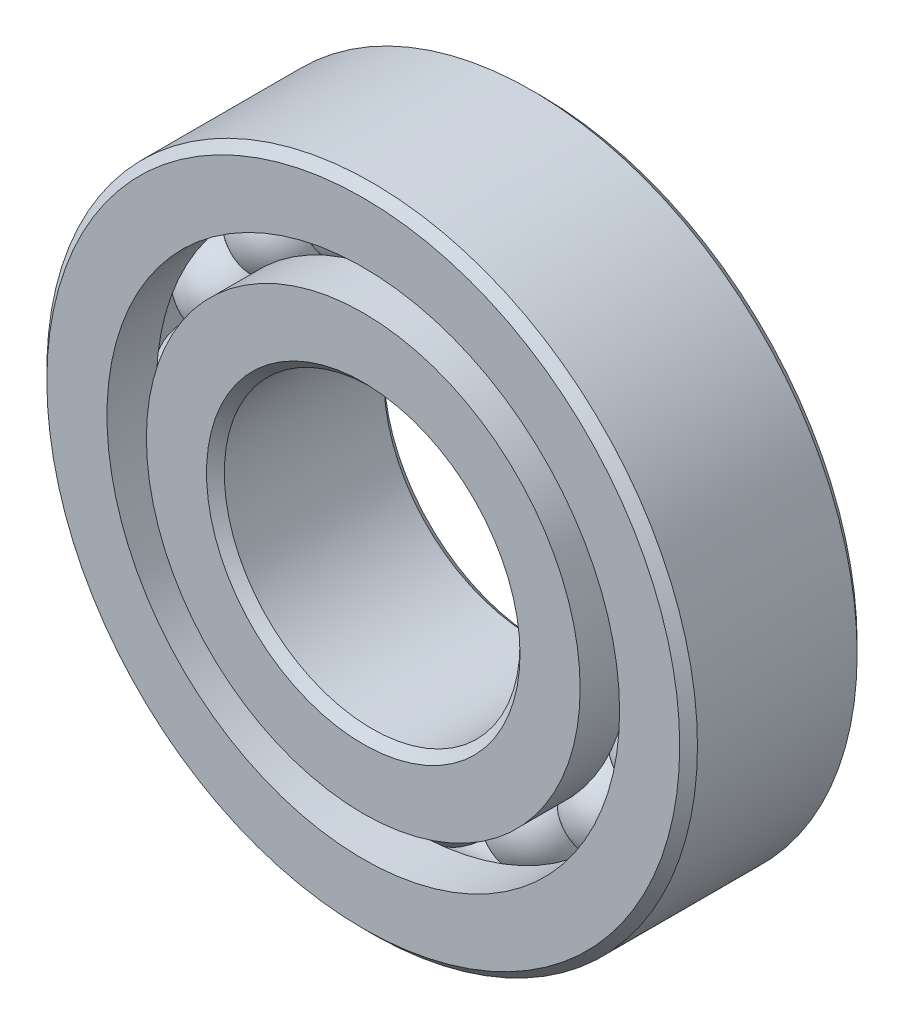
from build123d import *

# Parameters (mm, degrees)
CIRPATTERN1_COUNT = 16


with BuildPart() as part:
    # Sketch2 → Revolve1 (revolve)
    with BuildSketch(Plane(origin=(0, 0, 0), x_dir=(0, 0, -1), z_dir=(1, 0, 0))):
        with BuildLine():
            Line((-1.5, 3.666666667), (-0.666666667, 3.666666667))
            ThreePointArc((-0.666666667, 3.666666667), (0, 3.254644008), (0.666666667, 3.666666667))
            Line((0.666666667, 3.666666667), (1.5, 3.666666667))
            Line((1.5, 3.666666667), (1.5, 2.65))
            Line((1.5, 2.65), (1.35, 2.5))
            Line((1.35, 2.5), (-1.35, 2.5))
            Line((-1.35, 2.5), (-1.5, 2.65))
            Line((-1.5, 2.65), (-1.5, 3.666666667))
        make_face()
        with BuildLine():
            Line((1.35, 5.5), (1.5, 5.35))
            Line((1.5, 5.35), (1.5, 4.333333333))
            Line((1.5, 4.333333333), (0.666666667, 4.333333333))
            ThreePointArc((0.666666667, 4.333333333), (0, 4.745355992), (-0.666666667, 4.333333333))
            Line((-0.666666667, 4.333333333), (-1.5, 4.333333333))
            Line((-1.5, 4.333333333), (-1.5, 5.35))
            Line((-1.5, 5.35), (-1.35, 5.5))
            Line((-1.35, 5.5), (1.35, 5.5))
        make_face()
    revolve(axis=Axis((0, 0, 1.5), (0, 0, -1)))


with BuildPart() as body_2:
    # Sketch3 → Revolve2 (revolve)
    with BuildSketch(Plane(origin=(0, 0, 0), x_dir=(0, 0, -1), z_dir=(1, 0, 0))):
        with BuildLine():
            Line((-0.745355992, 4), (0.745355992, 4))
            ThreePointArc((0.745355992, 4), (0, 4.745355992), (-0.745355992, 4))
        make_face()
    revolve(axis=Axis((0, 4, 0.745355992), (0, 0, -1)))


with BuildPart() as cirpattern1_1:
    # CirPattern1: pattern copy
    add(body_2.part.rotate(Axis((0, 0, -1.5), (0, 0, 1)), 1 * 360 / CIRPATTERN1_COUNT))


with BuildPart() as cirpattern1_2:
    # CirPattern1: pattern copy
    add(body_2.part.rotate(Axis((0, 0, -1.5), (0, 0, 1)), 2 * 360 / CIRPATTERN1_COUNT))


with BuildPart() as cirpattern1_3:
    # CirPattern1: pattern copy
    add(body_2.part.rotate(Axis((0, 0, -1.5), (0, 0, 1)), 3 * 360 / CIRPATTERN1_COUNT))


with BuildPart() as cirpattern1_4:
    # CirPattern1: pattern copy
    add(body_2.part.rotate(Axis((0, 0, -1.5), (0, 0, 1)), 4 * 360 / CIRPATTERN1_COUNT))


with BuildPart() as cirpattern1_5:
    # CirPattern1: pattern copy
    add(body_2.part.rotate(Axis((0, 0, -1.5), (0, 0, 1)), 5 * 360 / CIRPATTERN1_COUNT))


with BuildPart() as cirpattern1_6:
    # CirPattern1: pattern copy
    add(body_2.part.rotate(Axis((0, 0, -1.5), (0, 0, 1)), 6 * 360 / CIRPATTERN1_COUNT))


with BuildPart() as cirpattern1_7:
    # CirPattern1: pattern copy
    add(body_2.part.rotate(Axis((0, 0, -1.5), (0, 0, 1)), 7 * 360 / CIRPATTERN1_COUNT))


with BuildPart() as cirpattern1_8:
    # CirPattern1: pattern copy
    add(body_2.part.rotate(Axis((0, 0, -1.5), (0, 0, 1)), 8 * 360 / CIRPATTERN1_COUNT))


with BuildPart() as cirpattern1_9:
    # CirPattern1: pattern copy
    add(body_2.part.rotate(Axis((0, 0, -1.5), (0, 0, 1)), 9 * 360 / CIRPATTERN1_COUNT))


with BuildPart() as cirpattern1_10:
    # CirPattern1: pattern copy
    add(body_2.part.rotate(Axis((0, 0, -1.5), (0, 0, 1)), 10 * 360 / CIRPATTERN1_COUNT))


with BuildPart() as cirpattern1_11:
    # CirPattern1: pattern copy
    add(body_2.part.rotate(Axis((0, 0, -1.5), (0, 0, 1)), 11 * 360 / CIRPATTERN1_COUNT))


with BuildPart() as cirpattern1_12:
    # CirPattern1: pattern copy
    add(body_2.part.rotate(Axis((0, 0, -1.5), (0, 0, 1)), 12 * 360 / CIRPATTERN1_COUNT))


with BuildPart() as cirpattern1_13:
    # CirPattern1: pattern copy
    add(body_2.part.rotate(Axis((0, 0, -1.5), (0, 0, 1)), 13 * 360 / CIRPATTERN1_COUNT))


with BuildPart() as cirpattern1_14:
    # CirPattern1: pattern copy
    add(body_2.part.rotate(Axis((0, 0, -1.5), (0, 0, 1)), 14 * 360 / CIRPATTERN1_COUNT))


with BuildPart() as cirpattern1_15:
    # CirPattern1: pattern copy
    add(body_2.part.rotate(Axis((0, 0, -1.5), (0, 0, 1)), 15 * 360 / CIRPATTERN1_COUNT))


solid = Compound([part.part, body_2.part, cirpattern1_1.part, cirpattern1_2.part, cirpattern1_3.part, cirpattern1_4.part, cirpattern1_5.part, cirpattern1_6.part, cirpattern1_7.part, cirpattern1_8.part, cirpattern1_9.part, cirpattern1_10.part, cirpattern1_11.part, cirpattern1_12.part, cirpattern1_13.part, cirpattern1_14.part, cirpattern1_15.part])
